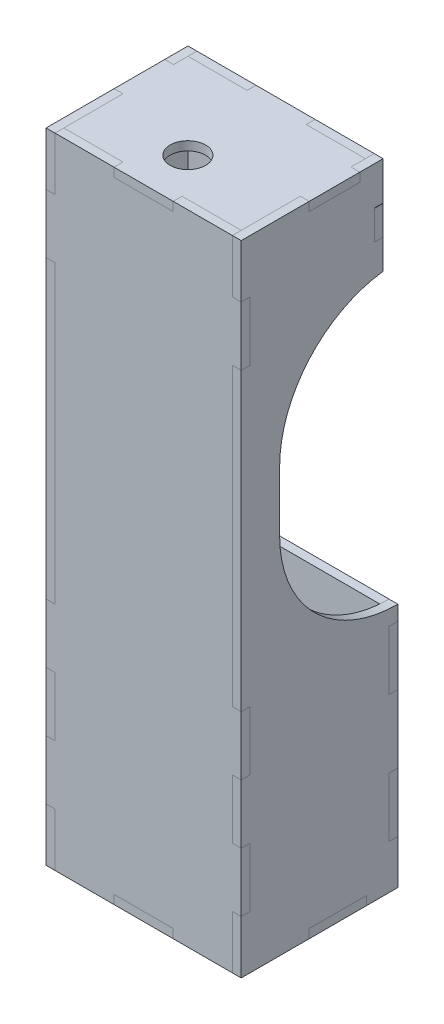
from build123d import *

# Parameters (mm, degrees)
BOSS_EXTRUDE1_DEPTH = 3
BOSS_EXTRUDE2_DEPTH = 3
SKETCH3_R           = 6
BOSS_EXTRUDE3_DEPTH = 3
BOSS_EXTRUDE4_DEPTH = 3
BOSS_EXTRUDE5_DEPTH = 3
BOSS_EXTRUDE6_DEPTH = 3
BOSS_EXTRUDE8_DEPTH = 3


with BuildPart() as part:
    # Sketch1 → Boss-Extrude1 (new body)
    with BuildSketch(Plane.XY):
        Polygon((0, 0), (0, 100), (-3, 100), (-3, 120), (0, 120), (0, 138), (20, 138), (20, 135), (40, 135), (40, 138), (60, 138), (60, 120), (63, 120), (63, 100), (60, 100), (60, 0), (63, 0), (63, -20), (60, -20), (60, -40), (63, -40), (63, -60), (60, -60), (60, -78), (40, -78), (40, -75), (20, -75), (20, -78), (0, -78), (0, -60), (-3, -60), (-3, -40), (0, -40), (0, -20), (-3, -20), (-3, 0), align=None)
    extrude(amount=BOSS_EXTRUDE1_DEPTH)


with BuildPart() as body_2:
    # Sketch2 → Boss-Extrude2 (new body)
    with BuildSketch(Plane(origin=(63, 0, 0), x_dir=(0, 0, -1), z_dir=(1, 0, 0))):
        with BuildLine():
            Line((45, 138), (37.098973903, 138))
            Line((37.098973903, 138), (37.098973903, 135))
            Line((37.098973903, 135), (20, 135))
            Line((20, 135), (20, 138))
            Line((20, 138), (-3, 138))
            Line((-3, 138), (-3, 120))
            Line((-3, 120), (0, 120))
            Line((0, 120), (0, 100))
            Line((0, 100), (-3, 100))
            Line((-3, 100), (-3, 0))
            Line((-3, 0), (0, 0))
            Line((0, 0), (0, -20))
            Line((0, -20), (-3, -20))
            Line((-3, -20), (-3, -40))
            Line((-3, -40), (0, -40))
            Line((0, -40), (0, -60))
            Line((0, -60), (-3, -60))
            Line((-3, -60), (-3, -78))
            Line((-3, -78), (20, -78))
            Line((20, -78), (20, -75))
            Line((20, -75), (39.331188529, -75))
            Line((39.331188529, -75), (39.331188529, -78))
            Line((39.331188529, -78), (50, -78))
            Line((50, -78), (50, -63))
            Line((50, -63), (47, -63))
            Line((47, -63), (47, -43))
            Line((47, -43), (50, -43))
            Line((50, -43), (50, -20))
            Line((50, -20), (47, -20))
            Line((47, -20), (47, 0))
            Line((47, 0), (50, 0))
            Line((50, 0), (50, 5))
            ThreePointArc((50, 5), (21.715728753, 16.715728753), (10, 45))
            Line((10, 45), (10, 65.313730334))
            ThreePointArc((10, 65.313730334), (20, 91.771243445), (45, 105))
            Line((45, 105), (45, 115))
            Line((45, 115), (42, 115))
            Line((42, 115), (42, 125))
            Line((42, 125), (45, 125))
            Line((45, 125), (45, 138))
        make_face()
    extrude(amount=-BOSS_EXTRUDE2_DEPTH)


with BuildPart() as body_3:
    # Sketch3 → Boss-Extrude3 (new body)
    with BuildSketch(Plane(origin=(0, 138, 0), x_dir=(1, 0, 0), z_dir=(0, 1, 0))):
        Polygon((60, 37.098973903), (63, 37.098973903), (63, 20), (60, 20), (60, 0), (40, 0), (40, -3), (20, -3), (20, 0), (0, 0), (0, 20), (-3, 20), (-3, 37.098973903), (0, 37.098973903), (0, 42), (20, 42), (20, 45), (40, 45), (40, 42), (60, 42), align=None)
        with Locations(Location((28.958057159, 13, 0), (0, 0, 270))):
            Circle(SKETCH3_R, mode=Mode.SUBTRACT)
    extrude(amount=-BOSS_EXTRUDE3_DEPTH)


with BuildPart() as body_4:
    # Sketch4 → Boss-Extrude4 (new body)
    with BuildSketch(Plane(origin=(0, 0, -45), x_dir=(-1, 0, 0), z_dir=(0, 0, -1))):
        Polygon((-63, 124.908408672), (-60, 125), (-60, 138), (-40, 138), (-40, 135), (-20, 135), (-20, 138), (0, 138), (0, 125), (3, 124.908408672), (3, 115), (0, 115), (0, 105), (-60, 105), (-60, 115), (-63, 115), align=None)
    extrude(amount=-BOSS_EXTRUDE4_DEPTH)


with BuildPart() as body_5:
    # Sketch5 → Boss-Extrude5 (new body)
    with BuildSketch(Plane(origin=(0, 0, -50), x_dir=(-1, 0, 0), z_dir=(0, 0, -1))):
        Polygon((-60, 5), (-60, 0), (-63, 0), (-63, -20), (-60, -20), (-60, -43), (-63, -43), (-63, -63), (-60, -63), (-60, -78), (-40, -78), (-40, -75), (-20, -75), (-20, -78), (0, -78), (0, -63), (3, -63), (3, -43), (0, -43), (0, -20), (3, -20), (3, 0), (0, 0), (0, 5), align=None)
    extrude(amount=-BOSS_EXTRUDE5_DEPTH)


with BuildPart() as body_6:
    # Sketch6 → Boss-Extrude6 (new body)
    with BuildSketch(Plane.XZ.offset(78)):
        Polygon((40, -50), (40, -47), (60, -47), (60, -39.331188529), (63, -39.331188529), (63, -20), (60, -20), (60, 0), (40, 0), (40, 3), (20, 3), (20, 0), (0, 0), (0, -20), (-3, -20), (-3, -39.331188529), (0, -39.331188529), (0, -47), (20, -47), (20, -50), align=None)
    extrude(amount=-BOSS_EXTRUDE6_DEPTH)


with BuildPart() as body_7:
    # Sketch7 → Boss-Extrude8 (new body)
    with BuildSketch(Plane.ZY.offset(3)):
        with BuildLine():
            Line((3, 138), (-20, 138))
            Line((-20, 138), (-20, 135))
            Line((-20, 135), (-37.098973903, 135))
            Line((-37.098973903, 135), (-37.098973903, 138))
            Line((-37.098973903, 138), (-45, 138))
            Line((-45, 138), (-45, 125))
            Line((-45, 125), (-42, 125))
            Line((-42, 125), (-42, 115))
            Line((-42, 115), (-45, 115))
            Line((-45, 115), (-45, 105))
            ThreePointArc((-45, 105), (-20, 91.771243445), (-10, 65.313730334))
            Line((-10, 65.313730334), (-10, 45))
            ThreePointArc((-10, 45), (-21.715728753, 16.715728753), (-50, 5))
            Line((-50, 5), (-50, 0))
            Line((-50, 0), (-47, 0))
            Line((-47, 0), (-47, -20))
            Line((-47, -20), (-50, -20))
            Line((-50, -20), (-50, -43))
            Line((-50, -43), (-47, -43))
            Line((-47, -43), (-47, -63))
            Line((-47, -63), (-50, -63))
            Line((-50, -63), (-50, -78))
            Line((-50, -78), (-39.331188529, -78))
            Line((-39.331188529, -78), (-39.331188529, -75))
            Line((-39.331188529, -75), (-20, -75))
            Line((-20, -75), (-20, -78))
            Line((-20, -78), (3, -78))
            Line((3, -78), (3, -60))
            Line((3, -60), (0, -60))
            Line((0, -60), (0, -40))
            Line((0, -40), (3, -40))
            Line((3, -40), (3, -20))
            Line((3, -20), (0, -20))
            Line((0, -20), (0, 0))
            Line((0, 0), (3, 0))
            Line((3, 0), (3, 100))
            Line((3, 100), (0, 100))
            Line((0, 100), (0, 120))
            Line((0, 120), (3, 120))
            Line((3, 120), (3, 138))
        make_face()
    extrude(amount=-BOSS_EXTRUDE8_DEPTH)


solid = Compound([part.part, body_2.part, body_3.part, body_4.part, body_5.part, body_6.part, body_7.part])
